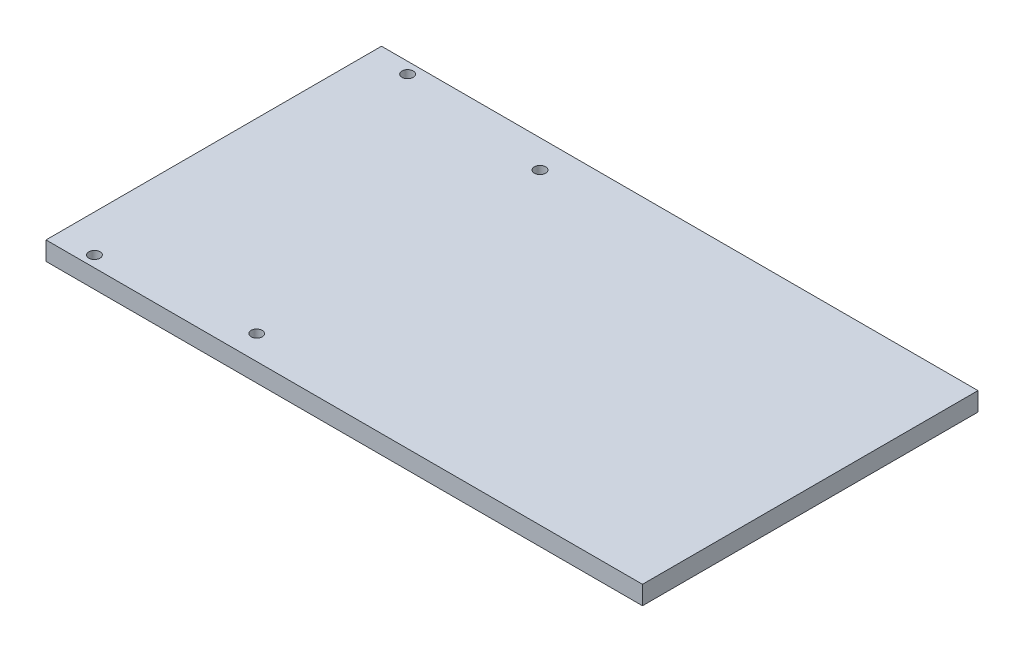
from build123d import *

# Parameters (mm, degrees)
SKETCH1_W           = 200
SKETCH1_H           = 90
SKETCH1_R           = 1.5
BOSS_EXTRUDE1_DEPTH = 5
SKETCH2_W           = 140
SKETCH2_H           = 90
CUT_EXTRUDE1_DEPTH  = 142.850408897
SKETCH3_R           = 1.5
CUT_EXTRUDE2_DEPTH  = 137.124210251
SKETCH4_W           = 90
SKETCH4_H           = 5
BOSS_EXTRUDE2_DEPTH = 100


with BuildPart() as part:
    # Sketch1 → Boss-Extrude1 (new body)
    with BuildSketch(Plane(origin=(0, 0, 0), x_dir=(1, 0, 0), z_dir=(0, 1, 0))):
        with Locations((3.97934472, -51.35784543)):
            Rectangle(SKETCH1_W, SKETCH1_H)
        with Locations(Location((-86.02065528, -9.35784543, 0), (0, 0, 270))):
            Circle(SKETCH1_R, mode=Mode.SUBTRACT)
        with Locations(Location((-86.02065528, -93.35784543, 0), (0, 0, 270))):
            Circle(SKETCH1_R, mode=Mode.SUBTRACT)
        with Locations(Location((93.97934472, -9.35784543, 0), (0, 0, 270))):
            Circle(SKETCH1_R, mode=Mode.SUBTRACT)
        with Locations(Location((93.97934472, -93.35784543, 0), (0, 0, 270))):
            Circle(SKETCH1_R, mode=Mode.SUBTRACT)
    extrude(amount=BOSS_EXTRUDE1_DEPTH)

    # Sketch2 → Cut-Extrude1 (cut, through all)
    with BuildSketch(Plane(origin=(0, 5, 0), x_dir=(1, 0, 0), z_dir=(0, 1, 0))):
        with Locations((33.97934472, -51.35784543)):
            Rectangle(SKETCH2_W, SKETCH2_H)
    extrude(amount=-CUT_EXTRUDE1_DEPTH, mode=Mode.SUBTRACT)

    # Sketch3 → Cut-Extrude2 (cut, through all)
    with BuildSketch(Plane(origin=(0, 5, 0), x_dir=(1, 0, 0), z_dir=(0, 1, 0))):
        with Locations(Location((-46.006691674, -13.85784543, 0), (0, 0, 270))):
            Circle(SKETCH3_R)
        with Locations(Location((-46.006691674, -89.85784543, 0), (0, 0, 270))):
            Circle(SKETCH3_R)
    extrude(amount=-CUT_EXTRUDE2_DEPTH, mode=Mode.SUBTRACT)

    # Sketch4 → Boss-Extrude2 (add)
    with BuildSketch(Plane(origin=(-36.02065528, 0, 0), x_dir=(0, 0, -1), z_dir=(1, 0, 0))):
        with Locations((-51.35784543, 2.5)):
            Rectangle(SKETCH4_W, SKETCH4_H)
    extrude(amount=BOSS_EXTRUDE2_DEPTH)


solid = part.part
